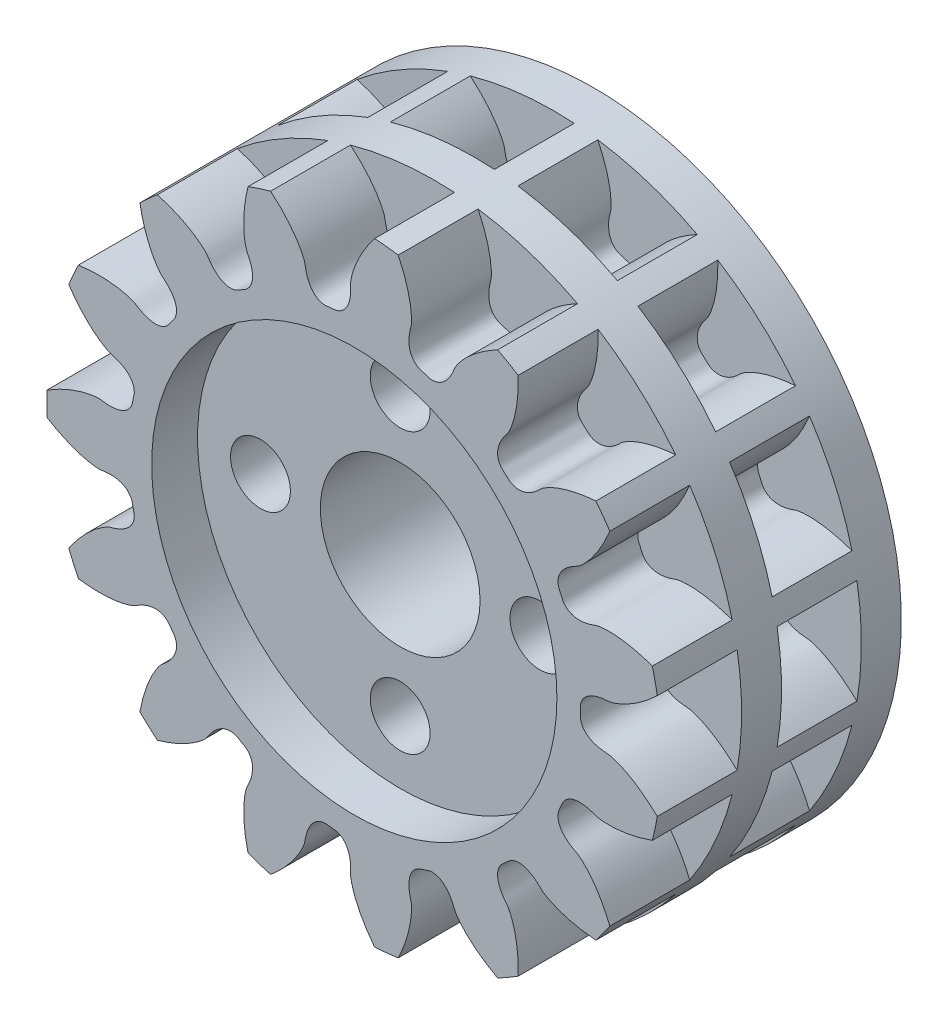
from build123d import *

# Parameters (mm, degrees)
SKETCHREVOLVESPURPINION_W       = 10
SKETCHREVOLVESPURPINION_H       = 15.402
TOOTHEXTRUDECUTSPURPINION_DEPTH = 4
PATTERNSPURPINION_COUNT         = 15
SKETCH_5_R                      = 10.15
CUT_EXTRUDE_2_DEPTH             = 2.3
CUT_EXTRUDE_4_DEPTH             = 4
PATTERN_CIRCULAR_1_COUNT        = 15
EXTRUDE_START                   = 2
SKETCH_9_R                      = 15.402
EXTRUDE_1_DEPTH                 = 2
CUT_EXTRUDE_3_DEPTH             = 24.843934577
CUT_EXTRUDE_3_DEPTH_BACK        = 24.843934577
SKETCH_6_R                      = 1.5
SKETCH_6_R_2                    = 4


with BuildPart() as part:
    # SketchRevolveSpurPinion → SpurPinion (revolve)
    with BuildSketch(Plane(origin=(0, 0, 0), x_dir=(0, 0, -1), z_dir=(1, 0, 0))):
        with Locations((0, 7.701)):
            Rectangle(SKETCHREVOLVESPURPINION_W, SKETCHREVOLVESPURPINION_H)
    revolve(axis=Axis((0, 0, 0), (0, 0, -1)))

    # SketchToothSpurPinion → ToothExtrudeCutSpurPinion (cut)
    with BuildSketch(Plane.XY.offset(5)):
        with BuildLine():
            ThreePointArc((15.256460451, 2.694637129), (15.4926, 0), (15.256460451, -2.694637129))
            add(Edge.make_bspline(
                [(15.256460451, -2.694637129), (15.120385023, -2.560929383), (14.915277056, -2.372070279), (14.636747523, -2.141579468), (14.439934895, -1.989780458), (14.250267645, -1.853607074), (14.068572261, -1.73237954), (13.895636639, -1.625379953), (13.732208457, -1.53185436), (13.578993585, -1.451015305), (13.436654912, -1.382041481), (13.305810114, -1.324087428), (13.187033224, -1.276261122), (13.080844553, -1.237703392), (12.987737091, -1.207351748), (12.908093059, -1.184658304), (12.738421466, -1.14038123), (12.572636283, -1.142200678), (12.417221849, -1.12169319), (12.37021895, -1.114728872), (12.32400049, -1.106879191), (12.278546078, -1.098197697), (12.2338497, -1.088662538), (12.189900183, -1.078268033), (12.146686392, -1.067000097), (12.104195961, -1.054842119), (12.062415798, -1.041772757), (12.0213322, -1.027765769), (11.980931192, -1.012789226), (11.941198939, -0.996804798), (11.902122339, -0.979766925), (11.863689806, -0.961621955), (11.825892304, -0.942307226), (11.788724706, -0.921750156), (11.752187538, -0.89986739), (11.716289202, -0.876564089), (11.681048755, -0.851733497), (11.646499326, -0.825256964), (11.612692221, -0.797004685), (11.579701725, -0.766837463), (11.547630497, -0.73460991), (11.516615324, -0.700175549), (11.486832783, -0.663394281), (11.458504071, -0.624142637), (11.431897928, -0.582326999), (11.407330398, -0.537899536), (11.385159489, -0.490876025), (11.365774888, -0.441353629), (11.349575832, -0.389526699), (11.336960827, -0.335694555), (11.328241275, -0.280268387), (11.324215258, -0.228723663), (11.322615761, -0.135194221), (11.326935996, 0), (11.322615761, 0.135194221), (11.324215258, 0.228723663), (11.328241275, 0.280268387), (11.336960827, 0.335694555), (11.349575832, 0.389526699), (11.365774888, 0.441353629), (11.385159489, 0.490876025), (11.407330398, 0.537899536), (11.431897928, 0.582326999), (11.458504071, 0.624142637), (11.486832783, 0.663394281), (11.516615324, 0.700175549), (11.547630497, 0.73460991), (11.579701725, 0.766837463), (11.612692221, 0.797004685), (11.646499326, 0.825256964), (11.681048755, 0.851733497), (11.716289202, 0.876564089), (11.752187538, 0.89986739), (11.788724706, 0.921750156), (11.825892304, 0.942307226), (11.863689806, 0.961621955), (11.902122339, 0.979766925), (11.941198939, 0.996804798), (11.980931192, 1.012789226), (12.0213322, 1.027765769), (12.062415798, 1.041772757), (12.104195961, 1.054842119), (12.146686392, 1.067000097), (12.189900183, 1.078268033), (12.2338497, 1.088662538), (12.278546078, 1.098197697), (12.32400049, 1.106879191), (12.37021895, 1.114728872), (12.417221849, 1.12169319), (12.572636283, 1.142200678), (12.738421466, 1.14038123), (12.908093059, 1.184658304), (12.987737091, 1.207351748), (13.080844553, 1.237703392), (13.187033224, 1.276261122), (13.305810114, 1.324087428), (13.436654912, 1.382041481), (13.578993585, 1.451015305), (13.732208457, 1.53185436), (13.895636639, 1.625379953), (14.068572261, 1.73237954), (14.250267645, 1.853607074), (14.439934895, 1.989780458), (14.636747523, 2.141579468), (14.915277056, 2.372070279), (15.120385023, 2.560929383), (15.256460451, 2.694637129)],
                knots=[0, 0, 0, 0, 0.056360502, 0.082315996, 0.106788319, 0.129777471, 0.151283452, 0.171306262, 0.189845901, 0.206902369, 0.222475666, 0.236565792, 0.249172746, 0.26029653, 0.269937143, 0.278094585, 0.284768856, 0.321669005, 0.326411926, 0.331089867, 0.335705376, 0.340261234, 0.34476047, 0.349206393, 0.353602615, 0.357953089, 0.362262134, 0.366534478, 0.370775293, 0.374990234, 0.379185482, 0.383367787, 0.387544497, 0.391723599, 0.395913739, 0.400124226, 0.404365023, 0.408646691, 0.412980305, 0.417377296, 0.421849222, 0.426407451, 0.431062723, 0.435824606, 0.440700822, 0.44569649, 0.450813317, 0.456048827, 0.461395741, 0.466841642, 0.472369055, 0.477956022, 0.482100342, 0.5, 0.517899658, 0.522043978, 0.527630945, 0.533158358, 0.538604259, 0.543951173, 0.549186683, 0.55430351, 0.559299178, 0.564175394, 0.568937277, 0.573592549, 0.578150778, 0.582622704, 0.587019695, 0.591353309, 0.595634977, 0.599875774, 0.604086261, 0.608276401, 0.612455503, 0.616632213, 0.620814518, 0.625009766, 0.629224707, 0.633465522, 0.637737866, 0.642046911, 0.646397385, 0.650793607, 0.65523953, 0.659738766, 0.664294624, 0.668910133, 0.673588074, 0.678330995, 0.715231144, 0.721905415, 0.730062857, 0.73970347, 0.750827254, 0.763434208, 0.777524334, 0.793097631, 0.810154099, 0.828693738, 0.848716548, 0.870222529, 0.893211681, 0.917684004, 0.943639498, 1, 1, 1, 1], degree=3))
        make_face()
    toothextrudecutspurpinion = extrude(amount=-TOOTHEXTRUDECUTSPURPINION_DEPTH, mode=Mode.SUBTRACT)

    # PatternSpurPinion: ToothExtrudeCutSpurPinion ×15 about axis
    patternspurpinion_axis = Axis((0, 0, 50), (0, 0, -1))
    for i in range(1, PATTERNSPURPINION_COUNT):
        add(toothextrudecutspurpinion.rotate(patternspurpinion_axis, i * 360 / PATTERNSPURPINION_COUNT), mode=Mode.SUBTRACT)

    # Эскиз5 → Вырез-Вытянуть2 (cut)
    with BuildSketch(Plane.XY.offset(5)):
        Circle(SKETCH_5_R)
    extrude(amount=-CUT_EXTRUDE_2_DEPTH, mode=Mode.SUBTRACT)

    # Эскиз8 → Вырез-Вытянуть4 (cut)
    with BuildSketch(Plane.XY.offset(-5)):
        with BuildLine():
            ThreePointArc((15.256460451, 2.694637129), (15.4926, 0), (15.256460451, -2.694637129))
            add(Edge.make_bspline(
                [(15.256460451, -2.694637129), (15.120385023, -2.560929383), (14.915277056, -2.372070279), (14.636747523, -2.141579468), (14.439934895, -1.989780458), (14.250267645, -1.853607074), (14.068572261, -1.73237954), (13.895636639, -1.625379953), (13.732208457, -1.53185436), (13.578993585, -1.451015305), (13.436654912, -1.382041481), (13.305810114, -1.324087428), (13.187033224, -1.276261122), (13.080844553, -1.237703392), (12.987737091, -1.207351748), (12.908093059, -1.184658304), (12.738421466, -1.14038123), (12.572636283, -1.142200678), (12.417221849, -1.12169319), (12.37021895, -1.114728872), (12.32400049, -1.106879191), (12.278546078, -1.098197697), (12.2338497, -1.088662538), (12.189900183, -1.078268033), (12.146686392, -1.067000097), (12.104195961, -1.054842119), (12.062415798, -1.041772757), (12.0213322, -1.027765769), (11.980931192, -1.012789226), (11.941198939, -0.996804798), (11.902122339, -0.979766925), (11.863689806, -0.961621955), (11.825892304, -0.942307226), (11.788724706, -0.921750156), (11.752187538, -0.89986739), (11.716289202, -0.876564089), (11.681048755, -0.851733497), (11.646499326, -0.825256964), (11.612692221, -0.797004685), (11.579701725, -0.766837463), (11.547630497, -0.73460991), (11.516615324, -0.700175549), (11.486832783, -0.663394281), (11.458504071, -0.624142637), (11.431897928, -0.582326999), (11.407330398, -0.537899536), (11.385159489, -0.490876025), (11.365774888, -0.441353629), (11.349575832, -0.389526699), (11.336960827, -0.335694555), (11.328241275, -0.280268387), (11.324215258, -0.228723663), (11.322615761, -0.135194221), (11.326935996, 0), (11.322615761, 0.135194221), (11.324215258, 0.228723663), (11.328241275, 0.280268387), (11.336960827, 0.335694555), (11.349575832, 0.389526699), (11.365774888, 0.441353629), (11.385159489, 0.490876025), (11.407330398, 0.537899536), (11.431897928, 0.582326999), (11.458504071, 0.624142637), (11.486832783, 0.663394281), (11.516615324, 0.700175549), (11.547630497, 0.73460991), (11.579701725, 0.766837463), (11.612692221, 0.797004685), (11.646499326, 0.825256964), (11.681048755, 0.851733497), (11.716289202, 0.876564089), (11.752187538, 0.89986739), (11.788724706, 0.921750156), (11.825892304, 0.942307226), (11.863689806, 0.961621955), (11.902122339, 0.979766925), (11.941198939, 0.996804798), (11.980931192, 1.012789226), (12.0213322, 1.027765769), (12.062415798, 1.041772757), (12.104195961, 1.054842119), (12.146686392, 1.067000097), (12.189900183, 1.078268033), (12.2338497, 1.088662538), (12.278546078, 1.098197697), (12.32400049, 1.106879191), (12.37021895, 1.114728872), (12.417221849, 1.12169319), (12.572636283, 1.142200678), (12.738421466, 1.14038123), (12.908093059, 1.184658304), (12.987737091, 1.207351748), (13.080844553, 1.237703392), (13.187033224, 1.276261122), (13.305810114, 1.324087428), (13.436654912, 1.382041481), (13.578993585, 1.451015305), (13.732208457, 1.53185436), (13.895636639, 1.625379953), (14.068572261, 1.73237954), (14.250267645, 1.853607074), (14.439934895, 1.989780458), (14.636747523, 2.141579468), (14.915277056, 2.372070279), (15.120385023, 2.560929383), (15.256460451, 2.694637129)],
                knots=[0, 0, 0, 0, 0.056360502, 0.082315996, 0.106788319, 0.129777471, 0.151283452, 0.171306262, 0.189845901, 0.206902369, 0.222475666, 0.236565792, 0.249172746, 0.26029653, 0.269937143, 0.278094585, 0.284768856, 0.321669005, 0.326411926, 0.331089867, 0.335705376, 0.340261234, 0.34476047, 0.349206393, 0.353602615, 0.357953089, 0.362262134, 0.366534478, 0.370775293, 0.374990234, 0.379185482, 0.383367787, 0.387544497, 0.391723599, 0.395913739, 0.400124226, 0.404365023, 0.408646691, 0.412980305, 0.417377296, 0.421849222, 0.426407451, 0.431062723, 0.435824606, 0.440700822, 0.44569649, 0.450813317, 0.456048827, 0.461395741, 0.466841642, 0.472369055, 0.477956022, 0.482100342, 0.5, 0.517899658, 0.522043978, 0.527630945, 0.533158358, 0.538604259, 0.543951173, 0.549186683, 0.55430351, 0.559299178, 0.564175394, 0.568937277, 0.573592549, 0.578150778, 0.582622704, 0.587019695, 0.591353309, 0.595634977, 0.599875774, 0.604086261, 0.608276401, 0.612455503, 0.616632213, 0.620814518, 0.625009766, 0.629224707, 0.633465522, 0.637737866, 0.642046911, 0.646397385, 0.650793607, 0.65523953, 0.659738766, 0.664294624, 0.668910133, 0.673588074, 0.678330995, 0.715231144, 0.721905415, 0.730062857, 0.73970347, 0.750827254, 0.763434208, 0.777524334, 0.793097631, 0.810154099, 0.828693738, 0.848716548, 0.870222529, 0.893211681, 0.917684004, 0.943639498, 1, 1, 1, 1], degree=3))
        make_face()
    cut_extrude_4 = extrude(amount=CUT_EXTRUDE_4_DEPTH, mode=Mode.SUBTRACT)

    # Круговой массив1: Вырез-Вытянуть4 ×15 about axis
    pattern_circular_1_axis = Axis((0, 0, -5), (0, 0, 1))
    for i in range(1, PATTERN_CIRCULAR_1_COUNT):
        add(cut_extrude_4.rotate(pattern_circular_1_axis, i * 360 / PATTERN_CIRCULAR_1_COUNT), mode=Mode.SUBTRACT)

    # Эскиз9 → Бобышка-Вытянуть1 (add)
    with BuildSketch(Plane(origin=(0, 0, -5), x_dir=(-1, 0, 0), z_dir=(0, 0, -1)).offset(EXTRUDE_START)):
        Circle(SKETCH_9_R)
    extrude(amount=-EXTRUDE_1_DEPTH)

    # Эскиз6 → Вырез-Вытянуть3 (cut, two sides: drawn at the far end of the back side and taken through both)
    with BuildSketch(Plane.XY.offset(2.7).offset(-CUT_EXTRUDE_3_DEPTH_BACK)):
        with Locations((0, 7)):
            Circle(SKETCH_6_R)
        with Locations((7, 0)):
            Circle(SKETCH_6_R)
        with Locations((0, -7)):
            Circle(SKETCH_6_R)
        with Locations((-7, 0)):
            Circle(SKETCH_6_R)
        Circle(SKETCH_6_R_2)
    extrude(amount=CUT_EXTRUDE_3_DEPTH + CUT_EXTRUDE_3_DEPTH_BACK, mode=Mode.SUBTRACT)


solid = part.part
